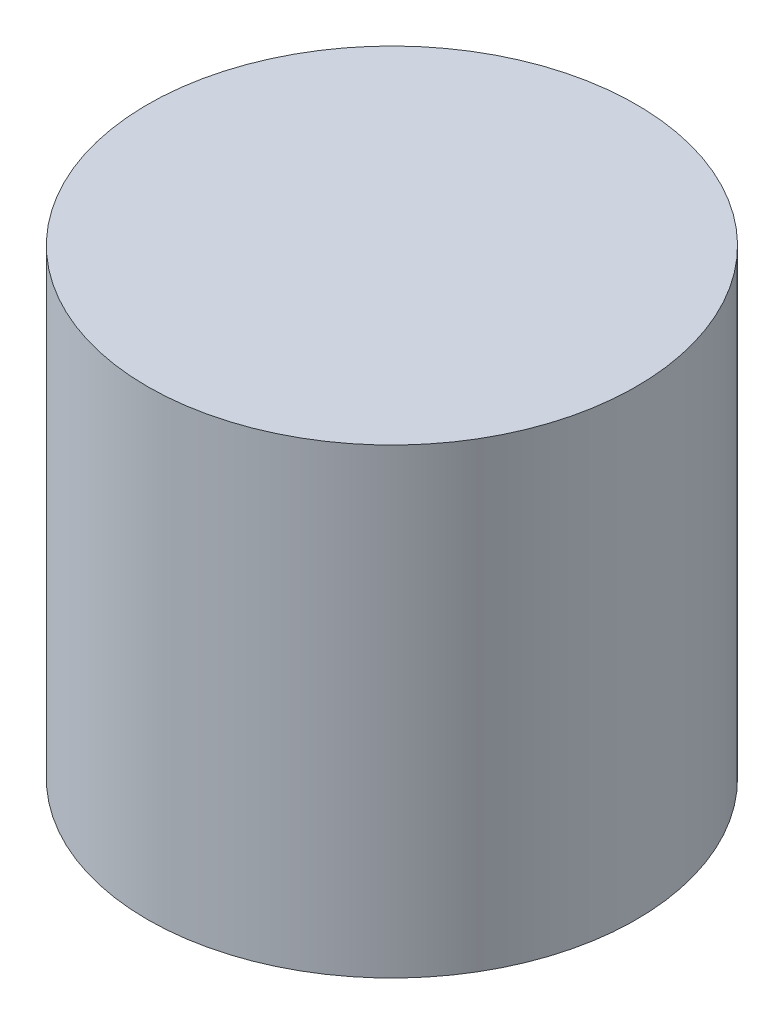
from build123d import *

# Parameters (mm, degrees)
SKETCH1_R           = 22.86
BOSS_EXTRUDE1_DEPTH = 43.18
SKETCH3_R           = 3.81
BOSS_EXTRUDE2_DEPTH = 2.54
BOSS_EXTRUDE2_TAPER = 52
CIRPATTERN1_COUNT   = 8


with BuildPart() as part:
    # Sketch1 → Boss-Extrude1 (new body)
    with BuildSketch(Plane(origin=(0, 0, 0), x_dir=(1, 0, 0), z_dir=(0, 1, 0))):
        Circle(SKETCH1_R)
    extrude(amount=BOSS_EXTRUDE1_DEPTH)

    # Sketch3 → Boss-Extrude2 (add)
    with BuildSketch(Plane(origin=(0, 0, 0), x_dir=(-1, 0, 0), z_dir=(0, -1, 0))):
        with Locations((0, 11.43)):
            Circle(SKETCH3_R)
    boss_extrude2 = extrude(amount=BOSS_EXTRUDE2_DEPTH, taper=BOSS_EXTRUDE2_TAPER)

    # CirPattern1: Boss-Extrude2 ×8 about axis
    cirpattern1_axis = Axis((0, 43.18, 0), (0, -1, 0))
    for i in range(1, CIRPATTERN1_COUNT):
        add(boss_extrude2.rotate(cirpattern1_axis, i * 360 / CIRPATTERN1_COUNT))


solid = part.part
